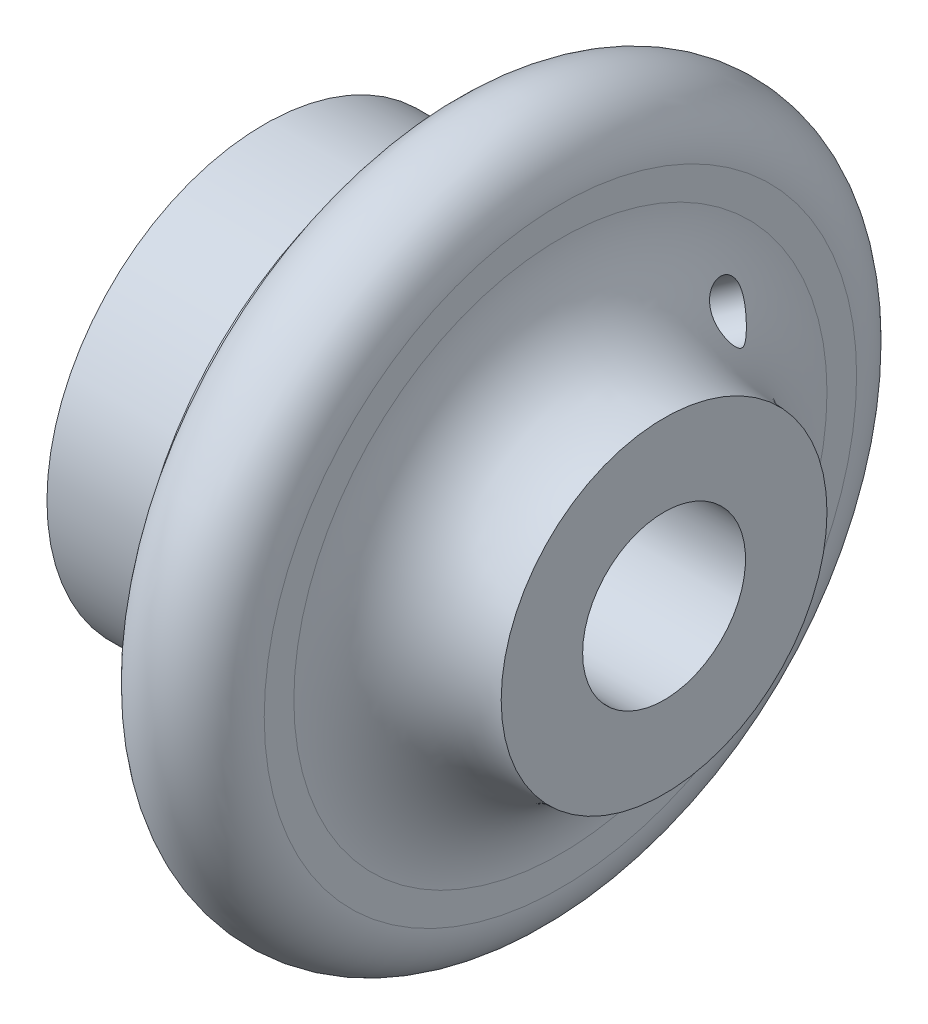
from build123d import *

# Parameters (mm, degrees)
F_3_6_3_6_DIAMETER_HOLE1_D     = 3.6
F_3_6_3_6_DIAMETER_HOLE1_DEPTH = 12
F_3_6_3_6_DIAMETER_HOLE1_TIP   = 1.081549114


with BuildPart() as part:
    # Sketch1 → Revolve1 (revolve)
    with BuildSketch(Plane.XY, mode=Mode.PRIVATE) as revolve1_sk:
        with BuildLine():
            Line((0, 14.67), (0, 5.5))
            Line((0, 5.5), (27, 5.5))
            Line((27, 5.5), (27, 11))
            ThreePointArc((27, 11), (22.050252532, 13.050252532), (20, 18))
            Line((20, 18), (20, 20))
            ThreePointArc((20, 20), (16, 24), (12, 20))
            Line((12, 20), (11, 20))
            Line((11, 20), (11, 13.17))
            Line((11, 13.17), (8, 13.17))
            Line((8, 13.17), (8, 14.67))
            Line((8, 14.67), (0, 14.67))
        make_face()
    revolve(revolve1_sk.sketch.rotate(Axis((0, 0, 0), (1, 0, 0)), 90), axis=Axis((0, 0, 0), (1, 0, 0)))

    # Ø3.6 (3.6) Diameter Hole1
    with Locations(Plane(origin=(21.47261693, 9.449479998, -9.92628458), x_dir=(0.49047083458, 0, 0.871457606787), z_dir=(0.789626152924, 0.423067471154, -0.444414731382))):
        with Locations((0, 0)):
            Hole(F_3_6_3_6_DIAMETER_HOLE1_D / 2, depth=F_3_6_3_6_DIAMETER_HOLE1_DEPTH)
            with Locations((0, 0, -(F_3_6_3_6_DIAMETER_HOLE1_DEPTH + F_3_6_3_6_DIAMETER_HOLE1_TIP / 2))):  # 118° drill point
                Cone(0, F_3_6_3_6_DIAMETER_HOLE1_D / 2, F_3_6_3_6_DIAMETER_HOLE1_TIP, mode=Mode.SUBTRACT)


solid = part.part
